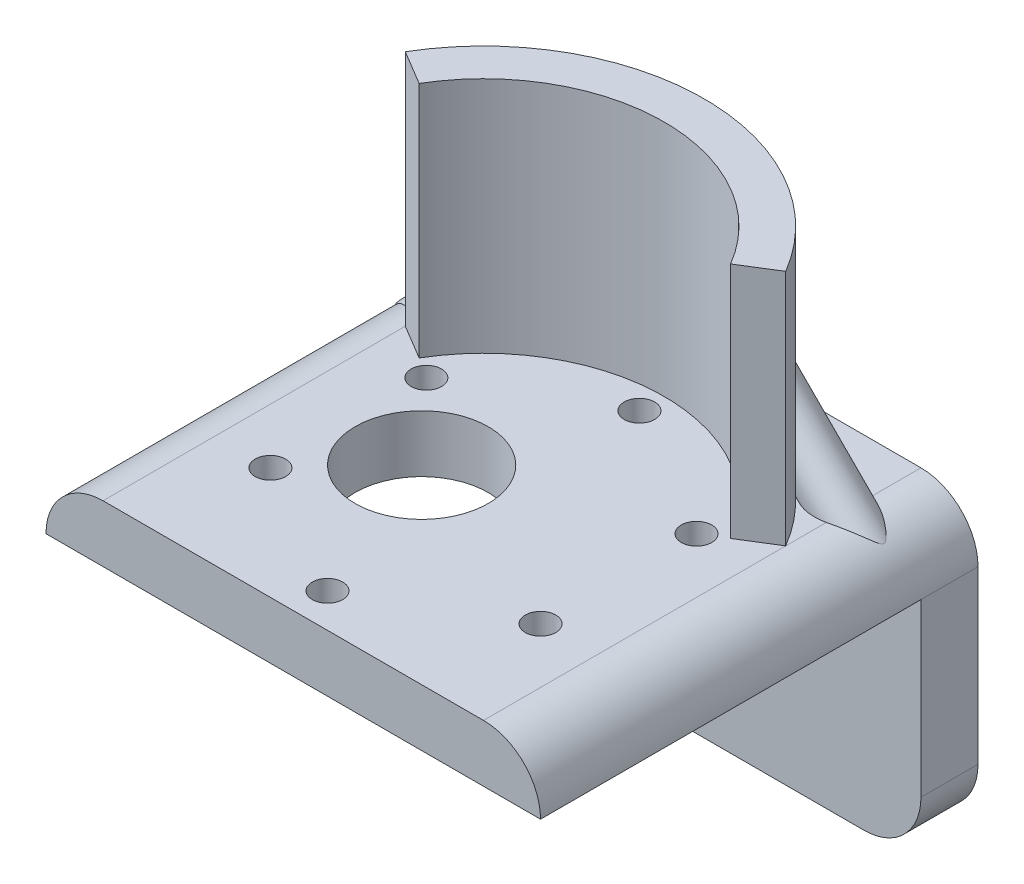
from build123d import *

# Parameters (mm, degrees)
BOSS_EXTRUDE1_DEPTH      = 6
BOSS_EXTRUDE2_DEPTH      = 40
CUT_EXTRUDE1_REACH       = 62.762
SKETCH9_R                = 1.6
CUT_EXTRUDE2_REACH       = 62.762
SKETCH10_R               = 7
BOSS_EXTRUDE4_DEPTH      = 25
BOSS_EXTRUDE5_REACH      = 73.576
SKETCH12_R               = 2.5
BOSS_EXTRUDE6_REACH      = 73.576
BOSS_EXTRUDE6_END_RADIUS = 23.21251372
SKETCH14_R               = 2.5
SKETCH17_W               = 26.966711831
SKETCH17_H               = 26.757667553
CUT_EXTRUDE4_DEPTH       = 6
FILLET1_R                = 2
SKETCH7_R                = 4
CUT_EXTRUDE5_DEPTH       = 3


with BuildPart() as part:
    # Sketch3 → Boss-Extrude1 (new body)
    with BuildSketch(Plane.XY):
        with BuildLine():
            Line((-20, 10.240601504), (20, 10.240601504))
            ThreePointArc((20, 10.240601504), (24.242640687, 8.483242191), (26, 4.240601504))
            Line((26, 4.240601504), (26, -13.759398496))
            ThreePointArc((26, -13.759398496), (24.242640687, -18.002039183), (20, -19.759398496))
            Line((20, -19.759398496), (-20, -19.759398496))
            ThreePointArc((-20, -19.759398496), (-24.242640687, -18.002039183), (-26, -13.759398496))
            Line((-26, -13.759398496), (-26, 4.240601504))
            ThreePointArc((-26, 4.240601504), (-24.242640687, 8.483242191), (-20, 10.240601504))
        make_face()
    extrude(amount=BOSS_EXTRUDE1_DEPTH)

    # Sketch4 → Boss-Extrude2 (add)
    with BuildSketch(Plane.XY.offset(6)):
        with BuildLine():
            Line((-26, 4.240601504), (26, 4.240601504))
            ThreePointArc((26, 4.240601504), (24.242640687, 8.483242191), (20, 10.240601504))
            Line((20, 10.240601504), (-20, 10.240601504))
            ThreePointArc((-20, 10.240601504), (-24.242640687, 8.483242191), (-26, 4.240601504))
        make_face()
    extrude(amount=BOSS_EXTRUDE2_DEPTH)

    # Sketch9 → Cut-Extrude1 (cut, up to next)
    with BuildSketch(Plane(origin=(0, 10.240601504, 0), x_dir=(1, 0, 0), z_dir=(0, 1, 0)), mode=Mode.PRIVATE) as cut_extrude1_sk1:
        with Locations(Location((0, -42.4, 0), (0, 0, 180))):
            Circle(SKETCH9_R)
    cut_extrude1_tool1 = extrude(cut_extrude1_sk1.sketch, amount=-CUT_EXTRUDE1_REACH, mode=Mode.PRIVATE) & part.part
    # Sketch9 → Cut-Extrude1 (cut, up to next)
    with BuildSketch(Plane(origin=(0, 10.240601504, 0), x_dir=(1, 0, 0), z_dir=(0, 1, 0)), mode=Mode.PRIVATE) as cut_extrude1_sk2:
        with Locations(Location((14.202816622, -34.2, 0), (0, 0, 180))):
            Circle(SKETCH9_R)
    cut_extrude1_tool2 = extrude(cut_extrude1_sk2.sketch, amount=-CUT_EXTRUDE1_REACH, mode=Mode.PRIVATE) & part.part
    # Sketch9 → Cut-Extrude1 (cut, up to next)
    with BuildSketch(Plane(origin=(0, 10.240601504, 0), x_dir=(1, 0, 0), z_dir=(0, 1, 0)), mode=Mode.PRIVATE) as cut_extrude1_sk3:
        with Locations(Location((-14.202816622, -34.2, 0), (0, 0, 180))):
            Circle(SKETCH9_R)
    cut_extrude1_tool3 = extrude(cut_extrude1_sk3.sketch, amount=-CUT_EXTRUDE1_REACH, mode=Mode.PRIVATE) & part.part
    # Sketch9 → Cut-Extrude1 (cut, up to next)
    with BuildSketch(Plane(origin=(0, 10.240601504, 0), x_dir=(1, 0, 0), z_dir=(0, 1, 0)), mode=Mode.PRIVATE) as cut_extrude1_sk4:
        with Locations(Location((-14.202816622, -17.8, 0), (0, 0, 180))):
            Circle(SKETCH9_R)
    cut_extrude1_tool4 = extrude(cut_extrude1_sk4.sketch, amount=-CUT_EXTRUDE1_REACH, mode=Mode.PRIVATE) & part.part
    # Sketch9 → Cut-Extrude1 (cut, up to next)
    with BuildSketch(Plane(origin=(0, 10.240601504, 0), x_dir=(1, 0, 0), z_dir=(0, 1, 0)), mode=Mode.PRIVATE) as cut_extrude1_sk5:
        with Locations(Location((0, -9.6, 0), (0, 0, 180))):
            Circle(SKETCH9_R)
    cut_extrude1_tool5 = extrude(cut_extrude1_sk5.sketch, amount=-CUT_EXTRUDE1_REACH, mode=Mode.PRIVATE) & part.part
    # Sketch9 → Cut-Extrude1 (cut, up to next)
    with BuildSketch(Plane(origin=(0, 10.240601504, 0), x_dir=(1, 0, 0), z_dir=(0, 1, 0)), mode=Mode.PRIVATE) as cut_extrude1_sk6:
        with Locations(Location((14.202816622, -17.8, 0), (0, 0, 180))):
            Circle(SKETCH9_R)
    cut_extrude1_tool6 = extrude(cut_extrude1_sk6.sketch, amount=-CUT_EXTRUDE1_REACH, mode=Mode.PRIVATE) & part.part
    add(cut_extrude1_tool1.solids().sort_by_distance((0, 10.240602, 42.4))[0], mode=Mode.SUBTRACT)
    add(cut_extrude1_tool2.solids().sort_by_distance((14.202817, 10.240602, 34.2))[0], mode=Mode.SUBTRACT)
    add(cut_extrude1_tool3.solids().sort_by_distance((-14.202817, 10.240602, 34.2))[0], mode=Mode.SUBTRACT)
    add(cut_extrude1_tool4.solids().sort_by_distance((-14.202817, 10.240602, 17.8))[0], mode=Mode.SUBTRACT)
    add(cut_extrude1_tool5.solids().sort_by_distance((0, 10.240602, 9.6))[0], mode=Mode.SUBTRACT)
    add(cut_extrude1_tool6.solids().sort_by_distance((14.202817, 10.240602, 17.8))[0], mode=Mode.SUBTRACT)

    # Sketch10 → Cut-Extrude2 (cut, up to next)
    with BuildSketch(Plane(origin=(0, 10.240601504, 0), x_dir=(1, 0, 0), z_dir=(0, 1, 0)), mode=Mode.PRIVATE) as cut_extrude2_sk1:
        with Locations(Location((-6.5, -26, 0), (0, 0, 180))):
            Circle(SKETCH10_R)
    cut_extrude2_tool1 = extrude(cut_extrude2_sk1.sketch, amount=-CUT_EXTRUDE2_REACH, mode=Mode.PRIVATE) & part.part
    add(cut_extrude2_tool1.solids().sort_by_distance((-6.5, 10.240602, 26))[0], mode=Mode.SUBTRACT)

    # Sketch11 → Boss-Extrude4 (add)
    with BuildSketch(Plane(origin=(0, 10.240601504, 0), x_dir=(1, 0, 0), z_dir=(0, 1, 0))):
        with BuildLine():
            Line((20, -14.217776389), (16.421656056, -16.443368147))
            ThreePointArc((16.421656056, -16.443368147), (0.037479345, -7.000036966), (-16.383825563, -16.378656023))
            Line((-16.383825563, -16.378656023), (-20, -14.217776389))
            ThreePointArc((-20, -14.217776389), (0, -2.78748628), (20, -14.217776389))
        make_face()
    extrude(amount=BOSS_EXTRUDE4_DEPTH)

    # Sketch12 → Boss-Extrude5 (add, up to next)
    with BuildSketch(Plane(origin=(7.879699248, -7.879699248, 0), x_dir=(0, 0, 1), z_dir=(-0.7071067811865489, 0.7071067811865462, 0)), mode=Mode.PRIVATE) as boss_extrude5_sk1:
        with Locations(Location((7.574761701, 20.594839086, 0), (0, 0, 90))):
            Circle(SKETCH12_R)
    boss_extrude5_tool1 = extrude(boss_extrude5_sk1.sketch, amount=BOSS_EXTRUDE5_REACH, mode=Mode.PRIVATE) - part.part
    add(boss_extrude5_tool1.solids().sort_by_distance((22.44245, 6.683051, 7.574762))[0])

    # Boss-Extrude6: up to this cylinder (the profile starts outside it)
    boss_extrude6_end = Plane(origin=(0, 6.81435, 26), z_dir=(0, -1, 0)) * Cylinder(BOSS_EXTRUDE6_END_RADIUS, 194.57702744, mode=Mode.PRIVATE)
    # Sketch14 → Boss-Extrude6 (add, up to the surface)
    with BuildSketch(Plane(origin=(-7.879699248, -7.879699248, 0), x_dir=(0, 0, -1), z_dir=(0.7071067811865487, 0.7071067811865465, 0)), mode=Mode.PRIVATE) as boss_extrude6_sk1:
        with Locations((-10.283332747, 20.780524406)):
            Circle(SKETCH14_R)
    boss_extrude6_tool1 = extrude(boss_extrude6_sk1.sketch, amount=BOSS_EXTRUDE6_REACH, mode=Mode.PRIVATE) - boss_extrude6_end
    add(boss_extrude6_tool1.solids().sort_by_distance((-22.573749, 6.81435, 10.283333))[0])

    # Sketch17 → Cut-Extrude4 (cut)
    with BuildSketch(Plane(origin=(0, 0, 0), x_dir=(-1, 0, 0), z_dir=(0, 0, -1))):
        with Locations((18.352928334, -9.138232272)):
            Rectangle(SKETCH17_W, SKETCH17_H)
    extrude(amount=-CUT_EXTRUDE4_DEPTH, mode=Mode.SUBTRACT)

    # Fillet1
    fillet1_edges = [part.edges().sort_by_distance(p)[0] for p in [
        (-4.869572418, -19.759398496, 3),
        (-4.869572418, 4.240601504, 3),
    ]]
    fillet(fillet1_edges, radius=FILLET1_R)

    # Sketch7 → Cut-Extrude5 (cut)
    with BuildSketch(Plane(origin=(0, 0, 0), x_dir=(-1, 0, 0), z_dir=(0, 0, -1))):
        with Locations((0, -4.759398496)):
            Circle(SKETCH7_R)
    extrude(amount=-CUT_EXTRUDE5_DEPTH, mode=Mode.SUBTRACT)


solid = part.part
